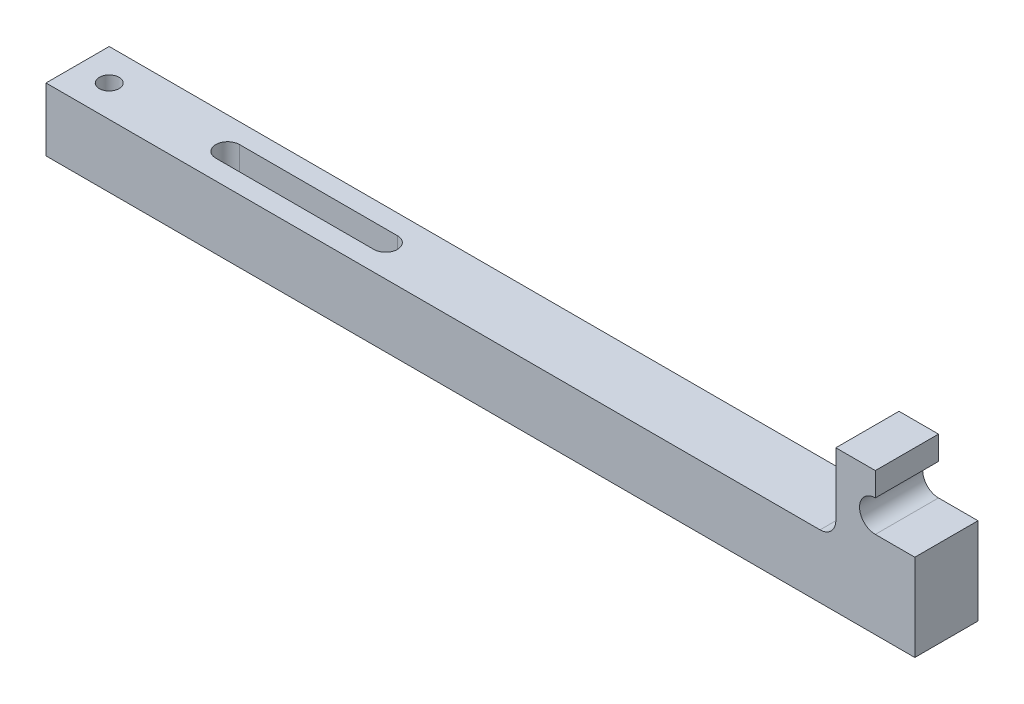
from build123d import *

# Parameters (mm, degrees)
BOSS_EXTRUDE2_DEPTH = 8
SKETCH3_R           = 1.25
CUT_EXTRUDE1_DEPTH  = 8
CUT_EXTRUDE2_DEPTH  = 8


with BuildPart() as part:
    # Sketch1 → Boss-Extrude2 (new body)
    with BuildSketch(Plane.XY):
        with BuildLine():
            Line((-29.531751908, 7.051775609), (-24.531751908, 7.051775609))
            Line((-24.531751908, 7.051775609), (-24.531751908, -3.948224391))
            Line((-24.531751908, -3.948224391), (-134.531751908, -3.948224391))
            Line((-134.531751908, -3.948224391), (-134.531751908, 4.051775609))
            Line((-134.531751908, 4.051775609), (-36.531751908, 4.051775609))
            ThreePointArc((-36.531751908, 4.051775609), (-35.117538345, 4.637562047), (-34.531751908, 6.051775609))
            Line((-34.531751908, 6.051775609), (-34.531751908, 14.051775609))
            Line((-34.531751908, 14.051775609), (-29.531751908, 14.051775609))
            Line((-29.531751908, 14.051775609), (-29.531751908, 11.051775609))
            ThreePointArc((-29.531751908, 11.051775609), (-31.531751908, 9.051775609), (-29.531751908, 7.051775609))
        make_face()
    extrude(amount=BOSS_EXTRUDE2_DEPTH)

    # Sketch3 → Cut-Extrude1 (cut)
    with BuildSketch(Plane(origin=(0, 4.051775609, 0), x_dir=(1, 0, 0), z_dir=(0, 1, 0))):
        with Locations(Location((-130.531751908, -4, 0), (0, 0, 270))):
            Circle(SKETCH3_R)
    extrude(amount=-CUT_EXTRUDE1_DEPTH, mode=Mode.SUBTRACT)

    # Sketch4 → Cut-Extrude2 (cut)
    with BuildSketch(Plane(origin=(0, 4.051775609, 0), x_dir=(1, 0, 0), z_dir=(0, 1, 0))):
        with BuildLine():
            Line((-115.531751908, -2.5), (-95.531751908, -2.5))
            ThreePointArc((-95.531751908, -2.5), (-94.031751908, -4), (-95.531751908, -5.5))
            Line((-95.531751908, -5.5), (-115.531751908, -5.5))
            ThreePointArc((-115.531751908, -5.5), (-117.031751908, -4), (-115.531751908, -2.5))
        make_face()
    extrude(amount=-CUT_EXTRUDE2_DEPTH, mode=Mode.SUBTRACT)


solid = part.part
